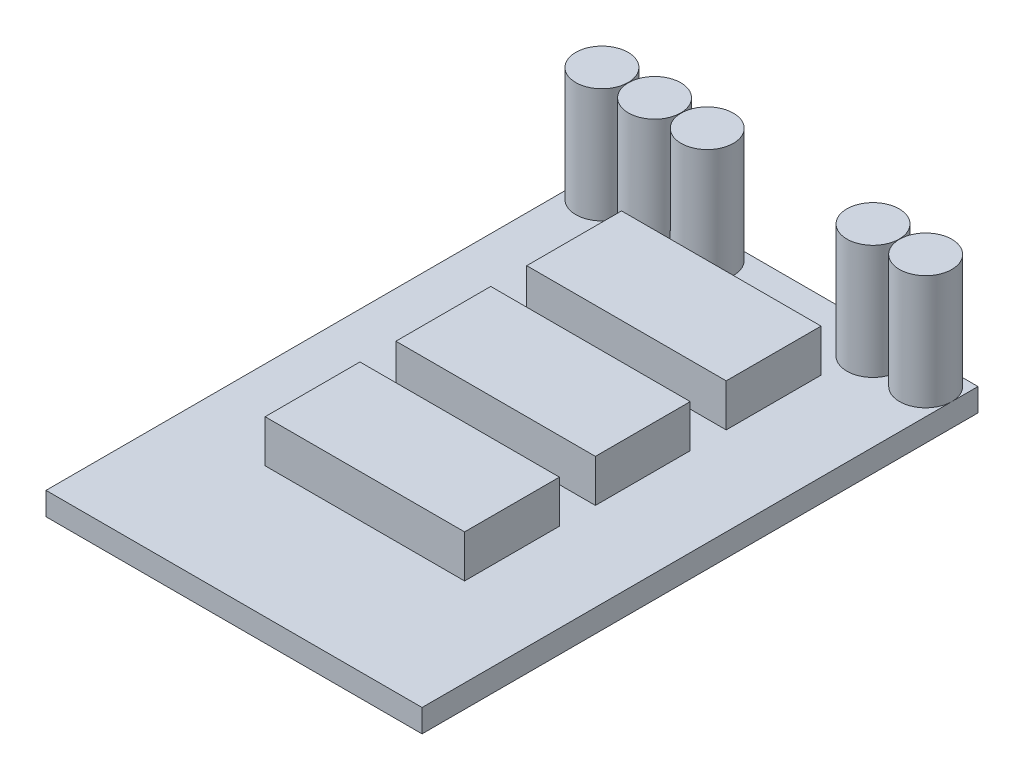
from build123d import *

# Parameters (mm, degrees)
SKETCH1_W           = 115
SKETCH1_H           = 170
BOSS_EXTRUDE1_DEPTH = 7
SKETCH2_W           = 61
SKETCH2_H           = 29
BOSS_EXTRUDE6_DEPTH = 13
SKETCH2_6_R         = 8
BOSS_EXTRUDE9_DEPTH = 35


with BuildPart() as part:
    # Sketch1 → Boss-Extrude1 (new body)
    with BuildSketch(Plane(origin=(0, 0, 0), x_dir=(1, 0, 0), z_dir=(0, 1, 0))):
        Rectangle(SKETCH1_W, SKETCH1_H)
    extrude(amount=BOSS_EXTRUDE1_DEPTH)

    # Sketch2 → Boss-Extrude6 (add)
    with BuildSketch(Plane(origin=(0, 7, 0), x_dir=(1, 0, 0), z_dir=(0, 1, 0))):
        with Locations((0, 49.5)):
            Rectangle(SKETCH2_W, SKETCH2_H)
        with Locations((0, -30.5)):
            Rectangle(SKETCH2_W, SKETCH2_H)
        with Locations((0, 9.5)):
            Rectangle(SKETCH2_W, SKETCH2_H)
    extrude(amount=BOSS_EXTRUDE6_DEPTH)

    # Sketch2<6> → Boss-Extrude9 (add)
    with BuildSketch(Plane(origin=(0, 7, 0), x_dir=(1, 0, 0), z_dir=(0, 1, 0))):
        with Locations((-49.5, 77)):
            Circle(SKETCH2_6_R)
        with Locations((-33.4, 77)):
            Circle(SKETCH2_6_R)
        with Locations((-17.3, 77)):
            Circle(SKETCH2_6_R)
        with Locations((33.4, 77)):
            Circle(SKETCH2_6_R)
        with Locations((49.5, 77)):
            Circle(SKETCH2_6_R)
    extrude(amount=BOSS_EXTRUDE9_DEPTH)


solid = part.part
